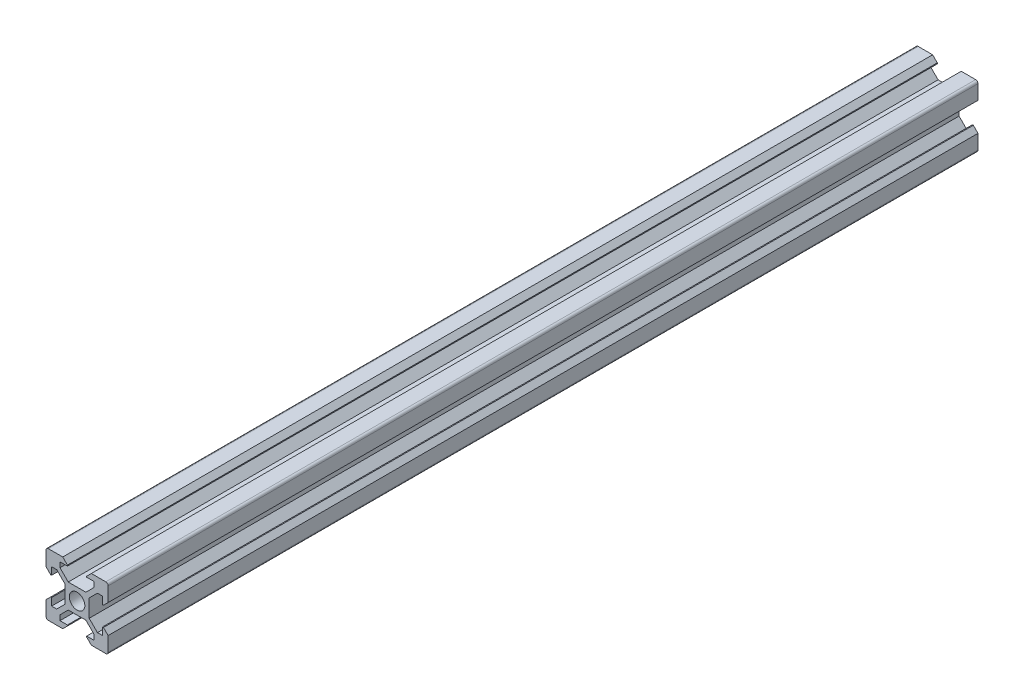
from build123d import *

# Parameters (mm, degrees)
CROQUIS1_R              = 2.5
SALIENTE_EXTRUIR1_DEPTH = 326
CUT_EXTRUDE1_DEPTH      = 47
CUT_EXTRUDE1_DEPTH_BACK = 30
SKETCH2_W               = 139.582587955
SKETCH2_H               = 242.432915921


with BuildPart() as part:
    # Croquis1 → Saliente-Extruir1 (new body)
    with BuildSketch(Plane.XY):
        with BuildLine():
            Line((-4.6, 10), (-3.1, 8.5))
            Line((-3.1, 8.5), (-3.1, 8.2))
            Line((-3.1, 8.2), (-5.5, 8.2))
            Line((-5.5, 8.2), (-5.5, 6.560660172))
            Line((-5.5, 6.560660172), (-2.84, 3.900660172))
            Line((-2.84, 3.900660172), (0, 3.900660172))
            Line((0, 3.900660172), (2.84, 3.900660172))
            Line((2.84, 3.900660172), (5.5, 6.560660172))
            Line((5.5, 6.560660172), (5.5, 8.2))
            Line((5.5, 8.2), (3.1, 8.2))
            Line((3.1, 8.2), (3.1, 8.5))
            Line((3.1, 8.5), (4.6, 10))
            Line((4.6, 10), (9.25, 10))
            ThreePointArc((9.25, 10), (9.780330086, 9.780330086), (10, 9.25))
            Line((10, 9.25), (10, 4.6))
            Line((10, 4.6), (8.5, 3.1))
            Line((8.5, 3.1), (8.2, 3.1))
            Line((8.2, 3.1), (8.2, 5.5))
            Line((8.2, 5.5), (6.560660172, 5.5))
            Line((6.560660172, 5.5), (3.900660172, 2.84))
            Line((3.900660172, 2.84), (3.900660172, 0))
            Line((3.900660172, 0), (3.900660172, -2.84))
            Line((3.900660172, -2.84), (6.560660172, -5.5))
            Line((6.560660172, -5.5), (8.2, -5.5))
            Line((8.2, -5.5), (8.2, -3.1))
            Line((8.2, -3.1), (8.5, -3.1))
            Line((8.5, -3.1), (10, -4.6))
            Line((10, -4.6), (10, -9.25))
            ThreePointArc((10, -9.25), (9.780330086, -9.780330086), (9.25, -10))
            Line((9.25, -10), (4.6, -10))
            Line((4.6, -10), (3.1, -8.5))
            Line((3.1, -8.5), (3.1, -8.2))
            Line((3.1, -8.2), (5.5, -8.2))
            Line((5.5, -8.2), (5.5, -6.560660172))
            Line((5.5, -6.560660172), (2.84, -3.900660172))
            Line((2.84, -3.900660172), (0, -3.900660172))
            Line((0, -3.900660172), (-2.84, -3.900660172))
            Line((-2.84, -3.900660172), (-5.5, -6.560660172))
            Line((-5.5, -6.560660172), (-5.5, -8.2))
            Line((-5.5, -8.2), (-3.1, -8.2))
            Line((-3.1, -8.2), (-3.1, -8.5))
            Line((-3.1, -8.5), (-4.6, -10))
            Line((-4.6, -10), (-9.25, -10))
            ThreePointArc((-9.25, -10), (-9.780330086, -9.780330086), (-10, -9.25))
            Line((-10, -9.25), (-10, -4.6))
            Line((-10, -4.6), (-8.5, -3.1))
            Line((-8.5, -3.1), (-8.2, -3.1))
            Line((-8.2, -3.1), (-8.2, -5.5))
            Line((-8.2, -5.5), (-6.560660172, -5.5))
            Line((-6.560660172, -5.5), (-3.900660172, -2.84))
            Line((-3.900660172, -2.84), (-3.900660172, 0))
            Line((-3.900660172, 0), (-3.900660172, 2.84))
            Line((-3.900660172, 2.84), (-6.560660172, 5.5))
            Line((-6.560660172, 5.5), (-8.2, 5.5))
            Line((-8.2, 5.5), (-8.2, 3.1))
            Line((-8.2, 3.1), (-8.5, 3.1))
            Line((-8.5, 3.1), (-10, 4.6))
            Line((-10, 4.6), (-10, 9.25))
            ThreePointArc((-10, 9.25), (-9.780330086, 9.780330086), (-9.25, 10))
            Line((-9.25, 10), (-4.6, 10))
        make_face()
        Circle(CROQUIS1_R, mode=Mode.SUBTRACT)
    extrude(amount=SALIENTE_EXTRUIR1_DEPTH)

    # Sketch2 → Cut-Extrude1 (cut, two sides: drawn at the far end of the back side and taken through both)
    with BuildSketch(Plane(origin=(0, 0, 0), x_dir=(1, 0, 0), z_dir=(0, 1, 0)).offset(-CUT_EXTRUDE1_DEPTH_BACK)):
        with Locations((12.355396541, -401.216457961)):
            Rectangle(SKETCH2_W, SKETCH2_H)
    extrude(amount=CUT_EXTRUDE1_DEPTH + CUT_EXTRUDE1_DEPTH_BACK, mode=Mode.SUBTRACT)


solid = part.part
